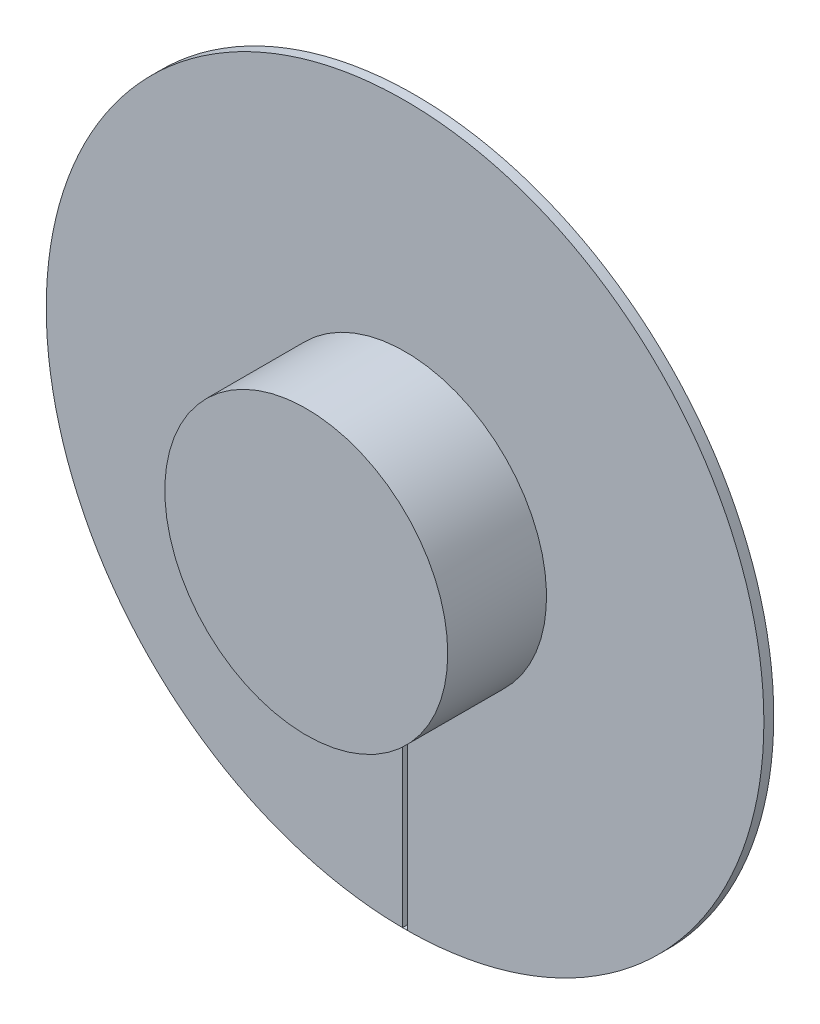
from build123d import *

# Parameters (mm, degrees)
ESQUISSE1_R             = 363.2
BOSS_EXTRU_1_DEPTH      = 10
ESQUISSE2_R             = 143.2
BOSS_EXTRU_2_DEPTH      = 100
ESQUISSE4_W             = 5
ESQUISSE4_H             = 220
ENL_V_MAT_EXTRU_1_DEPTH = 524.286231426


with BuildPart() as part:
    # Esquisse1 → Boss.-Extru.1 (new body)
    with BuildSketch(Plane.XY):
        Circle(ESQUISSE1_R)
    extrude(amount=BOSS_EXTRU_1_DEPTH)

    # Esquisse2 → Boss.-Extru.2 (add)
    with BuildSketch(Plane.XY.offset(10)):
        Circle(ESQUISSE2_R)
    extrude(amount=BOSS_EXTRU_2_DEPTH)

    # Esquisse4 → Enlèv. mat.-Extru.1 (cut, through all)
    with BuildSketch(Plane.XY.offset(10)):
        with Locations((0, -253.1)):
            Rectangle(ESQUISSE4_W, ESQUISSE4_H)
    extrude(amount=-ENL_V_MAT_EXTRU_1_DEPTH, mode=Mode.SUBTRACT)


solid = part.part
